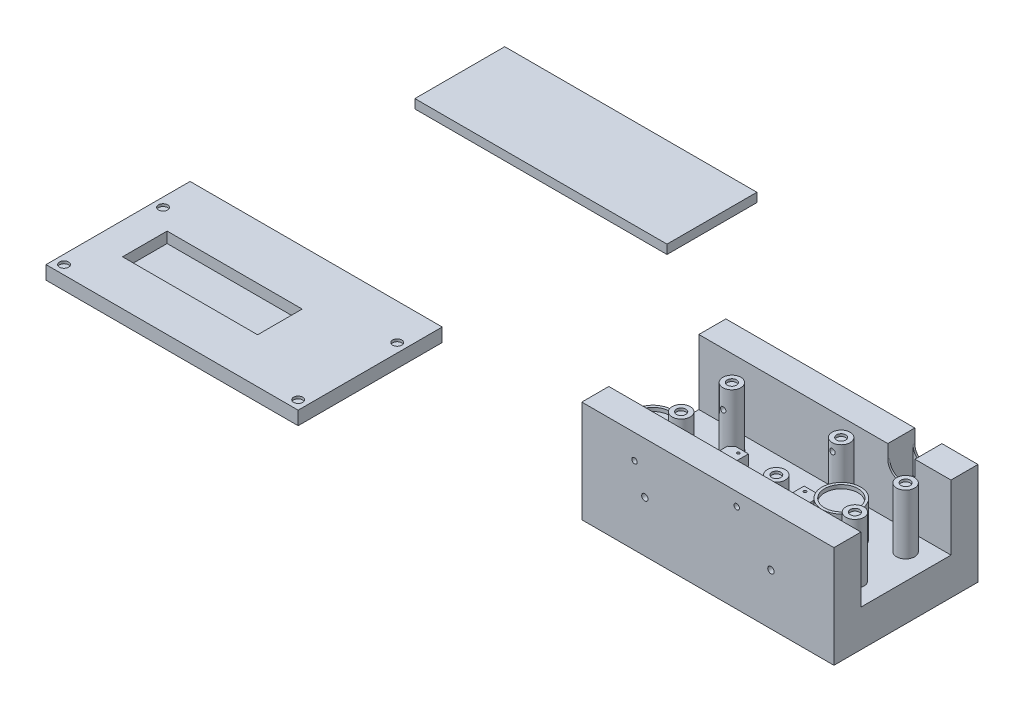
from build123d import *

# Parameters (mm, degrees)
SKETCH1_W                = 250
SKETCH1_H                = 100
BOSS_EXTRUDE1_DEPTH      = 41
SKETCH1_4_W              = 19.09
SKETCH1_4_H              = 45.76
BOSS_EXTRUDE2_DEPTH      = 12
SKETCH1_5_R              = 21.5
SKETCH1_5_R_2            = 18.55
BOSS_EXTRUDE3_DEPTH      = 39
SKETCH1_6_R              = 18.55
BOSS_EXTRUDE4_DEPTH      = 34.9
CUT_EXTRUDE1_START       = -5
SKETCH1_9_R              = 10
SKETCH1_9_R_2            = 5.17
CUT_EXTRUDE1_DEPTH       = 5
SKETCH1_10_R             = 10
SKETCH1_10_R_2           = 5.17
BOSS_EXTRUDE7_DEPTH      = 66.2
BOSS_EXTRUDE8_DEPTH      = 66.2
BOSS_EXTRUDE8_DEPTH_BACK = 5
SKETCH1_11_R             = 10
SKETCH1_11_R_2           = 5.17
CUT_EXTRUDE2_START       = 63.45
SKETCH1_12_R             = 5.17
CUT_EXTRUDE2_DEPTH       = 2.75
SKETCH3_R                = 1.5
CUT_EXTRUDE3_DEPTH       = 12
CUT_EXTRUDE4_DEPTH       = 31
SKETCH5_W                = 100
SKETCH5_H                = 41
BOSS_EXTRUDE9_DEPTH      = 30
SKETCH6_R                = 21.5
SKETCH6_R_2              = 18.55
BOSS_EXTRUDE10_DEPTH     = 39
SKETCH7_R                = 18.55
BOSS_EXTRUDE11_DEPTH     = 35
SKETCH10_R               = 10
SKETCH10_R_2             = 5.09
BOSS_EXTRUDE12_DEPTH     = 66.2
SKETCH11_R               = 5.17
BOSS_EXTRUDE13_DEPTH     = 63.45
CUT_EXTRUDE5_DEPTH       = 196.978162
CUT_EXTRUDE5_DEPTH_BACK  = 196.978162
SKETCH9_R                = 3
SKETCH15_W               = 280
SKETCH15_H               = 113.2
SKETCH15_R               = 3.5
BOSS_EXTRUDE17_DEPTH     = 30
SKETCH20_R               = 10.05
SKETCH20_R_2             = 18.55
BOSS_EXTRUDE18_DEPTH     = 4
SKETCH21_W               = 280
SKETCH21_H               = 100
SKETCH21_R               = 5.17
BOSS_EXTRUDE19_DEPTH     = 2.75
SKETCH22_W               = 280
SKETCH22_H               = 100
BOSS_EXTRUDE20_DEPTH     = 3.25
CUT_EXTRUDE9_DEPTH       = 680.103597
CUT_EXTRUDE9_DEPTH_BACK  = 680.103597
SKETCH24_R               = 11.817526
CUT_EXTRUDE10_DEPTH      = 680.103597
CUT_EXTRUDE10_DEPTH_BACK = 2.75
SKETCH25_R               = 5.17
SKETCH27_W               = 280
SKETCH27_H               = 130
SKETCH27_R               = 5.05
SKETCH27_W_2             = 150
SKETCH27_H_2             = 49.5
BOSS_EXTRUDE21_DEPTH     = 2.75
SKETCH28_W               = 280
SKETCH28_H               = 130
SKETCH28_W_2             = 150
SKETCH28_H_2             = 49.5
BOSS_EXTRUDE22_DEPTH     = 9.25
SKETCH29_W               = 280
SKETCH29_H               = 130
BOSS_EXTRUDE23_DEPTH     = 3
SKETCH33_R               = 3
CUT_EXTRUDE11_DEPTH      = 130
SKETCH34_R               = 3
CUT_EXTRUDE12_DEPTH      = 40
BOSS_EXTRUDE24_DEPTH     = 30
CUT_EXTRUDE13_DEPTH      = 45
SKETCH36_W               = 280
SKETCH36_H               = 15
BOSS_EXTRUDE25_DEPTH     = 30
SKETCH37_W               = 280
SKETCH37_H               = 10
CUT_EXTRUDE14_DEPTH      = 0.1
SKETCH38_W               = 280
SKETCH38_H               = 10
CUT_EXTRUDE15_DEPTH      = 0.1


with BuildPart() as part:
    # Sketch1 → Boss-Extrude1 (new body)
    with BuildSketch(Plane(origin=(0, 0, 0), x_dir=(1, 0, 0), z_dir=(0, 1, 0))):
        Rectangle(SKETCH1_W, SKETCH1_H)
    extrude(amount=-BOSS_EXTRUDE1_DEPTH)

    # Sketch1<4> → Boss-Extrude2 (add)
    with BuildSketch(Plane(origin=(0, 0, 0), x_dir=(1, 0, 0), z_dir=(0, 1, 0))):
        with BuildLine():
            Line((-72.79, 22.88), (-87.40331, 22.88))
            ThreePointArc((-87.40331, 22.88), (-89.331615, 20.463708), (-91.88, 18.713688))
            Line((-91.88, 18.713688), (-91.88, -18.713688))
            ThreePointArc((-91.88, -18.713688), (-89.331615, -20.463708), (-87.40331, -22.88))
            Line((-87.40331, -22.88), (-72.79, -22.88))
            Line((-72.79, -22.88), (-72.79, 22.88))
        make_face()
        with Locations((-1.415, 0)):
            Rectangle(SKETCH1_4_W, SKETCH1_4_H)
    extrude(amount=BOSS_EXTRUDE2_DEPTH)

    # Sketch1<5> → Boss-Extrude3 (add)
    with BuildSketch(Plane(origin=(0, 0, 0), x_dir=(1, 0, 0), z_dir=(0, 1, 0))):
        with Locations(Location((48.387034, 4.81425, 0), (0, 0, 90))):
            Circle(SKETCH1_5_R)
        with Locations(Location((48.387034, 4.81425, 0), (0, 0, 270))):
            Circle(SKETCH1_5_R_2, mode=Mode.SUBTRACT)
    extrude(amount=BOSS_EXTRUDE3_DEPTH)

    # Sketch1<6> → Boss-Extrude4 (add)
    with BuildSketch(Plane(origin=(0, 0, 0), x_dir=(1, 0, 0), z_dir=(0, 1, 0))):
        with Locations(Location((48.387034, 4.81425, 0), (0, 0, 270))):
            Circle(SKETCH1_6_R)
    extrude(amount=BOSS_EXTRUDE4_DEPTH)

    # Sketch1<9> → Cut-Extrude1 (cut)
    # profile 1 of 12: a face of its own
    with BuildSketch(Plane(origin=(0, 0, 0), x_dir=(1, 0, 0), z_dir=(0, 1, 0)).offset(CUT_EXTRUDE1_START)):
        with BuildLine():
            ThreePointArc((-87.40331, -22.88), (-89.331615, -20.463708), (-91.88, -18.713688))
            Line((-91.88, -18.713688), (-91.88, -19.273403))
            ThreePointArc((-91.88, -19.273403), (-89.689537, -20.813674), (-87.986347, -22.88))
            Line((-87.986347, -22.88), (-87.40331, -22.88))
        make_face()
    # profile 2 of 12: a face of its own
    with BuildSketch(Plane(origin=(0, 0, 0), x_dir=(1, 0, 0), z_dir=(0, 1, 0)).offset(CUT_EXTRUDE1_START)):
        with BuildLine():
            Line((-91.88, -19.273403), (-91.88, -18.713688))
            ThreePointArc((-91.88, -18.713688), (-105.390125, -33.71316), (-85.985, -28.15))
            ThreePointArc((-85.985, -28.15), (-86.345775, -25.421241), (-87.40331, -22.88))
            Line((-87.40331, -22.88), (-87.986347, -22.88))
            ThreePointArc((-87.986347, -22.88), (-86.867658, -25.410158), (-86.485, -28.15))
            ThreePointArc((-86.485, -28.15), (-105.030467, -33.343746), (-91.88, -19.273403))
        make_face()
    # profile 3 of 12: a face of its own
    with BuildSketch(Plane(origin=(0, 0, 0), x_dir=(1, 0, 0), z_dir=(0, 1, 0)).offset(CUT_EXTRUDE1_START)):
        with Locations((-96.485, -28.15)):
            Circle(SKETCH1_9_R)
        with Locations((-96.485, -28.15)):
            Circle(SKETCH1_9_R_2, mode=Mode.SUBTRACT)
    # profile 4 of 12: a face of its own
    with BuildSketch(Plane(origin=(0, 0, 0), x_dir=(1, 0, 0), z_dir=(0, 1, 0)).offset(CUT_EXTRUDE1_START)):
        with Locations((-96.485, -28.15)):
            Circle(SKETCH1_9_R_2)
    # profile 5 of 12: a face of its own
    with BuildSketch(Plane(origin=(0, 0, 0), x_dir=(1, 0, 0), z_dir=(0, 1, 0)).offset(CUT_EXTRUDE1_START)):
        with BuildLine():
            ThreePointArc((-86.485, 28.15), (-86.867658, 25.410158), (-87.986347, 22.88))
            Line((-87.986347, 22.88), (-87.40331, 22.88))
            ThreePointArc((-87.40331, 22.88), (-86.345775, 25.421241), (-85.985, 28.15))
            ThreePointArc((-85.985, 28.15), (-105.390125, 33.71316), (-91.88, 18.713688))
            Line((-91.88, 18.713688), (-91.88, 19.273403))
            ThreePointArc((-91.88, 19.273403), (-105.030467, 33.343746), (-86.485, 28.15))
        make_face()
    # profile 6 of 12: a face of its own
    with BuildSketch(Plane(origin=(0, 0, 0), x_dir=(1, 0, 0), z_dir=(0, 1, 0)).offset(CUT_EXTRUDE1_START)):
        with BuildLine():
            Line((-87.40331, 22.88), (-87.986347, 22.88))
            ThreePointArc((-87.986347, 22.88), (-89.689537, 20.813674), (-91.88, 19.273403))
            Line((-91.88, 19.273403), (-91.88, 18.713688))
            ThreePointArc((-91.88, 18.713688), (-89.331615, 20.463708), (-87.40331, 22.88))
        make_face()
    # profile 7 of 12: a face of its own
    with BuildSketch(Plane(origin=(0, 0, 0), x_dir=(1, 0, 0), z_dir=(0, 1, 0)).offset(CUT_EXTRUDE1_START)):
        with Locations((-96.485, 28.15)):
            Circle(SKETCH1_9_R)
        with Locations((-96.485, 28.15)):
            Circle(SKETCH1_9_R_2, mode=Mode.SUBTRACT)
    # profile 8 of 12: a face of its own
    with BuildSketch(Plane(origin=(0, 0, 0), x_dir=(1, 0, 0), z_dir=(0, 1, 0)).offset(CUT_EXTRUDE1_START)):
        with Locations((-96.485, 28.15)):
            Circle(SKETCH1_9_R_2)
    # profile 9 of 12: a face of its own
    with BuildSketch(Plane(origin=(0, 0, 0), x_dir=(1, 0, 0), z_dir=(0, 1, 0)).offset(CUT_EXTRUDE1_START)):
        with BuildLine():
            ThreePointArc((-87.40331, -22.88), (-89.331615, -20.463708), (-91.88, -18.713688))
            Line((-91.88, -18.713688), (-91.88, -19.273403))
            ThreePointArc((-91.88, -19.273403), (-89.689537, -20.813674), (-87.986347, -22.88))
            Line((-87.986347, -22.88), (-87.40331, -22.88))
        make_face()
    # profile 10 of 12: a face of its own
    with BuildSketch(Plane(origin=(0, 0, 0), x_dir=(1, 0, 0), z_dir=(0, 1, 0)).offset(CUT_EXTRUDE1_START)):
        with BuildLine():
            Line((-91.88, -19.273403), (-91.88, -18.713688))
            ThreePointArc((-91.88, -18.713688), (-105.390125, -33.71316), (-85.985, -28.15))
            ThreePointArc((-85.985, -28.15), (-86.345775, -25.421241), (-87.40331, -22.88))
            Line((-87.40331, -22.88), (-87.986347, -22.88))
            ThreePointArc((-87.986347, -22.88), (-86.867658, -25.410158), (-86.485, -28.15))
            ThreePointArc((-86.485, -28.15), (-105.030467, -33.343746), (-91.88, -19.273403))
        make_face()
    # profile 11 of 12: a face of its own
    with BuildSketch(Plane(origin=(0, 0, 0), x_dir=(1, 0, 0), z_dir=(0, 1, 0)).offset(CUT_EXTRUDE1_START)):
        with BuildLine():
            ThreePointArc((-86.485, 28.15), (-86.867658, 25.410158), (-87.986347, 22.88))
            Line((-87.986347, 22.88), (-87.40331, 22.88))
            ThreePointArc((-87.40331, 22.88), (-86.345775, 25.421241), (-85.985, 28.15))
            ThreePointArc((-85.985, 28.15), (-105.390125, 33.71316), (-91.88, 18.713688))
            Line((-91.88, 18.713688), (-91.88, 19.273403))
            ThreePointArc((-91.88, 19.273403), (-105.030467, 33.343746), (-86.485, 28.15))
        make_face()
    # profile 12 of 12: a face of its own
    with BuildSketch(Plane(origin=(0, 0, 0), x_dir=(1, 0, 0), z_dir=(0, 1, 0)).offset(CUT_EXTRUDE1_START)):
        with BuildLine():
            Line((-87.40331, 22.88), (-87.986347, 22.88))
            ThreePointArc((-87.986347, 22.88), (-89.689537, 20.813674), (-91.88, 19.273403))
            Line((-91.88, 19.273403), (-91.88, 18.713688))
            ThreePointArc((-91.88, 18.713688), (-89.331615, 20.463708), (-87.40331, 22.88))
        make_face()
    extrude(amount=CUT_EXTRUDE1_DEPTH, mode=Mode.SUBTRACT)

    # Sketch1<10> → Boss-Extrude7 (add)
    # profile 1 of 4: a face of its own
    with BuildSketch(Plane(origin=(0, 0, 0), x_dir=(1, 0, 0), z_dir=(0, 1, 0))):
        with Locations(Location((96.485, -28.15, 0), (0, 0, 90))):
            Circle(SKETCH1_10_R)
        with Locations((96.485, -28.15)):
            Circle(SKETCH1_10_R_2, mode=Mode.SUBTRACT)
    # profile 2 of 4: a face of its own
    with BuildSketch(Plane(origin=(0, 0, 0), x_dir=(1, 0, 0), z_dir=(0, 1, 0))):
        with Locations((96.485, -28.15)):
            Circle(SKETCH1_10_R_2)
    # profile 3 of 4: a face of its own
    with BuildSketch(Plane(origin=(0, 0, 0), x_dir=(1, 0, 0), z_dir=(0, 1, 0))):
        with Locations(Location((96.485, 28.15, 0), (0, 0, 90))):
            Circle(SKETCH1_10_R)
        with Locations((96.485, 28.15)):
            Circle(SKETCH1_10_R_2, mode=Mode.SUBTRACT)
    # profile 4 of 4: a face of its own
    with BuildSketch(Plane(origin=(0, 0, 0), x_dir=(1, 0, 0), z_dir=(0, 1, 0))):
        with Locations((96.485, 28.15)):
            Circle(SKETCH1_10_R_2)
    extrude(amount=BOSS_EXTRUDE7_DEPTH)


with BuildPart() as body_2:
    # Sketch1<11> → Boss-Extrude8 (new, two sides: drawn at the far end of the back side and taken through both)
    # profile 1 of 4: a face of its own
    with BuildSketch(Plane(origin=(0, 0, 0), x_dir=(1, 0, 0), z_dir=(0, 1, 0)).offset(-BOSS_EXTRUDE8_DEPTH_BACK)):
        with Locations(Location((-96.485, -28.15, 0), (0, 0, 270))):
            Circle(SKETCH1_11_R)
        with Locations((-96.485, -28.15)):
            Circle(SKETCH1_11_R_2, mode=Mode.SUBTRACT)
    # profile 2 of 4: a face of its own
    with BuildSketch(Plane(origin=(0, 0, 0), x_dir=(1, 0, 0), z_dir=(0, 1, 0)).offset(-BOSS_EXTRUDE8_DEPTH_BACK)):
        with Locations((-96.485, -28.15)):
            Circle(SKETCH1_11_R_2)
    # profile 3 of 4: a face of its own
    with BuildSketch(Plane(origin=(0, 0, 0), x_dir=(1, 0, 0), z_dir=(0, 1, 0)).offset(-BOSS_EXTRUDE8_DEPTH_BACK)):
        with Locations(Location((-96.485, 28.15, 0), (0, 0, 270))):
            Circle(SKETCH1_11_R)
        with Locations((-96.485, 28.15)):
            Circle(SKETCH1_11_R_2, mode=Mode.SUBTRACT)
    # profile 4 of 4: a face of its own
    with BuildSketch(Plane(origin=(0, 0, 0), x_dir=(1, 0, 0), z_dir=(0, 1, 0)).offset(-BOSS_EXTRUDE8_DEPTH_BACK)):
        with Locations((-96.485, 28.15)):
            Circle(SKETCH1_11_R_2)
    extrude(amount=BOSS_EXTRUDE8_DEPTH + BOSS_EXTRUDE8_DEPTH_BACK)


with BuildPart() as cut_extrude2_tool:
    # Sketch1<12> → Cut-Extrude2 (new body)
    with BuildSketch(Plane(origin=(0, 0, 0), x_dir=(1, 0, 0), z_dir=(0, 1, 0)).offset(CUT_EXTRUDE2_START)):
        with Locations(Location((-96.485, 28.15, 0), (0, 0, 270))):
            Circle(SKETCH1_12_R)
        with Locations(Location((-96.485, -28.15, 0), (0, 0, 270))):
            Circle(SKETCH1_12_R)
        with Locations(Location((96.485, 28.15, 0), (0, 0, 270))):
            Circle(SKETCH1_12_R)
        with Locations(Location((96.485, -28.15, 0), (0, 0, 270))):
            Circle(SKETCH1_12_R)
    extrude(amount=CUT_EXTRUDE2_DEPTH)


with BuildPart() as part_1:
    add(part.part)

    # Cut-Extrude2: cut by cut_extrude2_tool
    add(cut_extrude2_tool.part, mode=Mode.SUBTRACT)

    # Sketch3 → Cut-Extrude3 (cut)
    with BuildSketch(Plane(origin=(0, 12, 0), x_dir=(1, 0, 0), z_dir=(0, 1, 0))):
        with Locations(Location((-79.254798, 18.133761, 0), (0, 0, 270))):
            Circle(SKETCH3_R)
        with Locations(Location((-79.254798, 0.133761, 0), (0, 0, 270))):
            Circle(SKETCH3_R)
        with Locations(Location((-5.254798, 18.133761, 0), (0, 0, 270))):
            Circle(SKETCH3_R)
        with Locations(Location((-5.254798, 0.133761, 0), (0, 0, 270))):
            Circle(SKETCH3_R)
    extrude(amount=-CUT_EXTRUDE3_DEPTH, mode=Mode.SUBTRACT)

    # Sketch4 → Cut-Extrude4 (cut)
    with BuildSketch(Plane.XZ.offset(41)):
        with BuildLine():
            Line((-120, 30), (-39.475448, 30))
            ThreePointArc((-39.475448, 30), (-27.657923, 41.817526), (-15.840397, 30))
            Line((-15.840397, 30), (30, 30))
            Line((30, 30), (30, -19.5))
            Line((30, -19.5), (-120, -19.5))
            Line((-120, -19.5), (-120, 30))
        make_face()
    extrude(amount=-CUT_EXTRUDE4_DEPTH, mode=Mode.SUBTRACT)

    # Sketch5 → Boss-Extrude9 (add)
    with BuildSketch(Plane.ZY.offset(125)):
        with Locations((0, -20.5)):
            Rectangle(SKETCH5_W, SKETCH5_H)
    extrude(amount=BOSS_EXTRUDE9_DEPTH)

    # Sketch6 → Boss-Extrude10 (add)
    with BuildSketch(Plane(origin=(0, 0, 0), x_dir=(1, 0, 0), z_dir=(0, 1, 0))):
        with Locations(Location((-130.5, -25.5, 0), (0, 0, 90))):
            Circle(SKETCH6_R)
        with Locations(Location((-130.5, -25.5, 0), (0, 0, 270))):
            Circle(SKETCH6_R_2, mode=Mode.SUBTRACT)
    extrude(amount=BOSS_EXTRUDE10_DEPTH)

    # Sketch7 → Boss-Extrude11 (add)
    with BuildSketch(Plane(origin=(0, 0, 0), x_dir=(1, 0, 0), z_dir=(0, 1, 0))):
        with Locations(Location((-130.5, -25.5, 0), (0, 0, 270))):
            Circle(SKETCH7_R)
    extrude(amount=BOSS_EXTRUDE11_DEPTH)

    # Sketch10 → Boss-Extrude12 (add)
    # profile 1 of 2: a face of its own
    with BuildSketch(Plane(origin=(0, 0, 0), x_dir=(1, 0, 0), z_dir=(0, 1, 0))):
        with Locations(Location((17, -36, 0), (0, 0, 90))):
            Circle(SKETCH10_R)
        with Locations(Location((17, -36, 0), (0, 0, 270))):
            Circle(SKETCH10_R_2, mode=Mode.SUBTRACT)
    # profile 2 of 2: a face of its own
    with BuildSketch(Plane(origin=(0, 0, 0), x_dir=(1, 0, 0), z_dir=(0, 1, 0))):
        with Locations(Location((17, 36, 0), (0, 0, 90))):
            Circle(SKETCH10_R)
        with Locations(Location((17, 36, 0), (0, 0, 90))):
            Circle(SKETCH10_R_2, mode=Mode.SUBTRACT)
    extrude(amount=BOSS_EXTRUDE12_DEPTH)

    # Sketch11 → Boss-Extrude13 (add)
    with BuildSketch(Plane(origin=(0, 0, 0), x_dir=(1, 0, 0), z_dir=(0, 1, 0))):
        with Locations((17, -36)):
            Circle(SKETCH11_R)
        with Locations((17, 36)):
            Circle(SKETCH11_R)
    extrude(amount=BOSS_EXTRUDE13_DEPTH)


with BuildPart() as body_2_1:
    add(body_2.part)

    # Cut-Extrude2: cut by cut_extrude2_tool
    add(cut_extrude2_tool.part, mode=Mode.SUBTRACT)


with BuildPart() as cut_extrude5_tool:
    # Sketch9 → Cut-Extrude5 (new, two sides: drawn at the far end of the back side and taken through both)
    with BuildSketch(Plane.XY.offset(50).offset(-CUT_EXTRUDE5_DEPTH_BACK)):
        with Locations((-96.485, 45)):
            Circle(SKETCH9_R)
        with Locations((17, 57.6)):
            Circle(SKETCH9_R)
    extrude(amount=CUT_EXTRUDE5_DEPTH + CUT_EXTRUDE5_DEPTH_BACK)


with BuildPart() as part_2:
    add(part_1.part)

    # Cut-Extrude5: cut by cut_extrude5_tool
    add(cut_extrude5_tool.part, mode=Mode.SUBTRACT)

    # Sketch15 → Boss-Extrude17 (add)
    with BuildSketch(Plane.XY.offset(50)):
        with Locations((-15, 15.6)):
            Rectangle(SKETCH15_W, SKETCH15_H)
        with Locations((-85, 15.6)):
            Circle(SKETCH15_R, mode=Mode.SUBTRACT)
        with Locations((55, 15.6)):
            Circle(SKETCH15_R, mode=Mode.SUBTRACT)
    extrude(amount=BOSS_EXTRUDE17_DEPTH)

    # Sketch24 → Cut-Extrude9 (cut, two sides: drawn at the far end of the back side and taken through both)
    with BuildSketch(Plane.XZ.offset(41).offset(-CUT_EXTRUDE9_DEPTH_BACK)):
        with Locations(Location((-27.657923, 30, 0), (0, 0, 270))):
            Circle(SKETCH24_R)
    extrude(amount=CUT_EXTRUDE9_DEPTH + CUT_EXTRUDE9_DEPTH_BACK, mode=Mode.SUBTRACT)

    # Sketch25 → Cut-Extrude10 (cut, two sides: drawn at the far end of the back side and taken through both)
    with BuildSketch(Plane.XZ.offset(41).offset(-CUT_EXTRUDE10_DEPTH_BACK)):
        with Locations(Location((-145, -40, 0), (0, 0, 90))):
            Circle(SKETCH25_R)
        with Locations(Location((115, 70, 0), (0, 0, 90))):
            Circle(SKETCH25_R)
        with Locations(Location((115, -40, 0), (0, 0, 90))):
            Circle(SKETCH25_R)
        with Locations(Location((-145, 70, 0), (0, 0, 90))):
            Circle(SKETCH25_R)
    extrude(amount=CUT_EXTRUDE10_DEPTH + CUT_EXTRUDE10_DEPTH_BACK, mode=Mode.SUBTRACT)

    # Sketch33 → Cut-Extrude11 (cut)
    with BuildSketch(Plane.XY.offset(80)):
        with Locations((-96.485, 45)):
            Circle(SKETCH33_R)
        with Locations((17, 57.6)):
            Circle(SKETCH33_R)
    extrude(amount=-CUT_EXTRUDE11_DEPTH, mode=Mode.SUBTRACT)

    # Sketch34 → Cut-Extrude12 (cut)
    with BuildSketch(Plane.ZY.offset(155)):
        with Locations((4, -25.5)):
            Circle(SKETCH34_R)
    extrude(amount=-CUT_EXTRUDE12_DEPTH, mode=Mode.SUBTRACT)

    # Sketch31 → Boss-Extrude24 (add)
    with BuildSketch(Plane(origin=(0, 0, -50), x_dir=(-1, 0, 0), z_dir=(0, 0, -1))):
        with BuildLine():
            Line((-125, 72.2), (-84.937034, 72.2))
            Line((-84.937034, 72.2), (-84.937034, 57.15))
            ThreePointArc((-84.937034, 57.15), (-69.887034, 42.1), (-54.837034, 57.15))
            Line((-54.837034, 57.15), (-54.837034, 72.2))
            Line((-54.837034, 72.2), (155, 72.2))
            Line((155, 72.2), (155, -41))
            Line((155, -41), (-125, -41))
            Line((-125, -41), (-125, 72.2))
        make_face()
    extrude(amount=BOSS_EXTRUDE24_DEPTH)

    # Sketch35 → Cut-Extrude13 (cut)
    with BuildSketch(Plane(origin=(0, 72.2, 0), x_dir=(1, 0, 0), z_dir=(0, 1, 0))):
        Polygon((54.837034, 52), (69.887034, 52), (84.937034, 52), (84.937034, 78), (54.837034, 78), align=None)
    extrude(amount=-CUT_EXTRUDE13_DEPTH, mode=Mode.SUBTRACT)


with BuildPart() as body_2_2:
    add(body_2_1.part)

    # Cut-Extrude5: cut by cut_extrude5_tool
    add(cut_extrude5_tool.part, mode=Mode.SUBTRACT)


with BuildPart() as body_3:
    # Sketch20 → Boss-Extrude18 (new body)
    # profile 1 of 2: a face of its own
    with BuildSketch(Plane(origin=(0, 0, 0), x_dir=(1, 0, 0), z_dir=(0, 1, 0))):
        with BuildLine():
            Line((-605.779914, 285.303611), (-605.779914, 235.303611))
            Line((-605.779914, 235.303611), (-420.307274, 235.303611))
            ThreePointArc((-420.307274, 235.303611), (-404.820894, 258.508273), (-383.842881, 240.117861))
            ThreePointArc((-383.842881, 240.117861), (-384.002469, 237.689848), (-384.478487, 235.303611))
            Line((-384.478487, 235.303611), (-325.779914, 235.303611))
            Line((-325.779914, 235.303611), (-325.779914, 285.303611))
            Line((-325.779914, 285.303611), (-605.779914, 285.303611))
        make_face()
        with Locations(Location((-547.264914, 263.453611, 0), (0, 0, 270))):
            Circle(SKETCH20_R, mode=Mode.SUBTRACT)
        with Locations(Location((-433.779914, 271.303611, 0), (0, 0, 270))):
            Circle(SKETCH20_R, mode=Mode.SUBTRACT)
        with Locations(Location((-354.294914, 263.453611, 0), (0, 0, 270))):
            Circle(SKETCH20_R, mode=Mode.SUBTRACT)
    # profile 2 of 2: a face of its own
    with BuildSketch(Plane(origin=(0, 0, 0), x_dir=(1, 0, 0), z_dir=(0, 1, 0))):
        with BuildLine():
            Line((-420.307274, 235.303611), (-605.779914, 235.303611))
            Line((-605.779914, 235.303611), (-605.779914, 185.303611))
            Line((-605.779914, 185.303611), (-325.779914, 185.303611))
            Line((-325.779914, 185.303611), (-325.779914, 235.303611))
            Line((-325.779914, 235.303611), (-384.478487, 235.303611))
            ThreePointArc((-384.478487, 235.303611), (-402.392881, 221.567861), (-420.307274, 235.303611))
        make_face()
        with Locations(Location((-581.279914, 209.803611, 0), (0, 0, 270))):
            Circle(SKETCH20_R_2, mode=Mode.SUBTRACT)
        with Locations(Location((-547.264914, 207.153611, 0), (0, 0, 270))):
            Circle(SKETCH20_R, mode=Mode.SUBTRACT)
        with Locations(Location((-433.779914, 199.303611, 0), (0, 0, 270))):
            Circle(SKETCH20_R, mode=Mode.SUBTRACT)
        with Locations(Location((-354.294914, 207.153611, 0), (0, 0, 270))):
            Circle(SKETCH20_R, mode=Mode.SUBTRACT)
    extrude(amount=-BOSS_EXTRUDE18_DEPTH)

    # Sketch21 → Boss-Extrude19 (add)
    with BuildSketch(Plane(origin=(0, 0, 0), x_dir=(1, 0, 0), z_dir=(0, 1, 0))):
        with Locations((-465.779914, 235.303611)):
            Rectangle(SKETCH21_W, SKETCH21_H)
        with Locations(Location((-547.264914, 263.453611, 0), (0, 0, 270))):
            Circle(SKETCH21_R, mode=Mode.SUBTRACT)
        with Locations(Location((-433.779914, 271.303611, 0), (0, 0, 270))):
            Circle(SKETCH21_R, mode=Mode.SUBTRACT)
        with Locations(Location((-354.294914, 263.453611, 0), (0, 0, 270))):
            Circle(SKETCH21_R, mode=Mode.SUBTRACT)
        with Locations(Location((-354.294914, 207.153611, 0), (0, 0, 90))):
            Circle(SKETCH21_R, mode=Mode.SUBTRACT)
        with Locations(Location((-433.779914, 199.303611, 0), (0, 0, 90))):
            Circle(SKETCH21_R, mode=Mode.SUBTRACT)
        with Locations(Location((-547.264914, 207.153611, 0), (0, 0, 90))):
            Circle(SKETCH21_R, mode=Mode.SUBTRACT)
    extrude(amount=BOSS_EXTRUDE19_DEPTH)

    # Sketch22 → Boss-Extrude20 (add)
    with BuildSketch(Plane(origin=(0, 2.75, 0), x_dir=(1, 0, 0), z_dir=(0, 1, 0))):
        with Locations((-465.779914, 235.303611)):
            Rectangle(SKETCH22_W, SKETCH22_H)
    extrude(amount=BOSS_EXTRUDE20_DEPTH)

    # Sketch37 → Cut-Extrude14 (cut)
    with BuildSketch(Plane.XY.offset(-185.303611)):
        with Locations((-465.779914, 1)):
            Rectangle(SKETCH37_W, SKETCH37_H)
    extrude(amount=-CUT_EXTRUDE14_DEPTH, mode=Mode.SUBTRACT)

    # Sketch38 → Cut-Extrude15 (cut)
    with BuildSketch(Plane(origin=(0, 0, -285.303611), x_dir=(-1, 0, 0), z_dir=(0, 0, -1))):
        with Locations((465.779914, 1)):
            Rectangle(SKETCH38_W, SKETCH38_H)
    extrude(amount=-CUT_EXTRUDE15_DEPTH, mode=Mode.SUBTRACT)


with BuildPart() as body_4:
    # Sketch27 → Boss-Extrude21 (new body)
    with BuildSketch(Plane.XZ.offset(41)):
        with Locations((-557.916271, 67.102647)):
            Rectangle(SKETCH27_W, SKETCH27_H)
        with Locations(Location((-687.916271, 122.102647, 0), (0, 0, 270))):
            Circle(SKETCH27_R, mode=Mode.SUBTRACT)
        with Locations(Location((-687.916271, 12.102647, 0), (0, 0, 90))):
            Circle(SKETCH27_R, mode=Mode.SUBTRACT)
        with Locations(Location((-427.916271, 12.102647, 0), (0, 0, 270))):
            Circle(SKETCH27_R, mode=Mode.SUBTRACT)
        with Locations(Location((-427.916271, 122.102647, 0), (0, 0, 90))):
            Circle(SKETCH27_R, mode=Mode.SUBTRACT)
        with Locations((-587.916271, 57.352647)):
            Rectangle(SKETCH27_W_2, SKETCH27_H_2, mode=Mode.SUBTRACT)
    extrude(amount=BOSS_EXTRUDE21_DEPTH)

    # Sketch28 → Boss-Extrude22 (add)
    with BuildSketch(Plane.XZ.offset(43.75)):
        with Locations((-557.916271, 67.102647)):
            Rectangle(SKETCH28_W, SKETCH28_H)
        with Locations((-587.916271, 57.352647)):
            Rectangle(SKETCH28_W_2, SKETCH28_H_2, mode=Mode.SUBTRACT)
    extrude(amount=BOSS_EXTRUDE22_DEPTH)

    # Sketch29 → Boss-Extrude23 (add)
    with BuildSketch(Plane.XZ.offset(53)):
        with Locations((-557.916271, 67.102647)):
            Rectangle(SKETCH29_W, SKETCH29_H)
    extrude(amount=BOSS_EXTRUDE23_DEPTH)

    # Sketch36 → Boss-Extrude25 (add)
    with BuildSketch(Plane(origin=(0, 0, 2.102647), x_dir=(-1, 0, 0), z_dir=(0, 0, -1))):
        with Locations((557.916271, -48.5)):
            Rectangle(SKETCH36_W, SKETCH36_H)
    extrude(amount=BOSS_EXTRUDE25_DEPTH)


solid = Compound([part_2.part, body_2_2.part, body_3.part, body_4.part])
